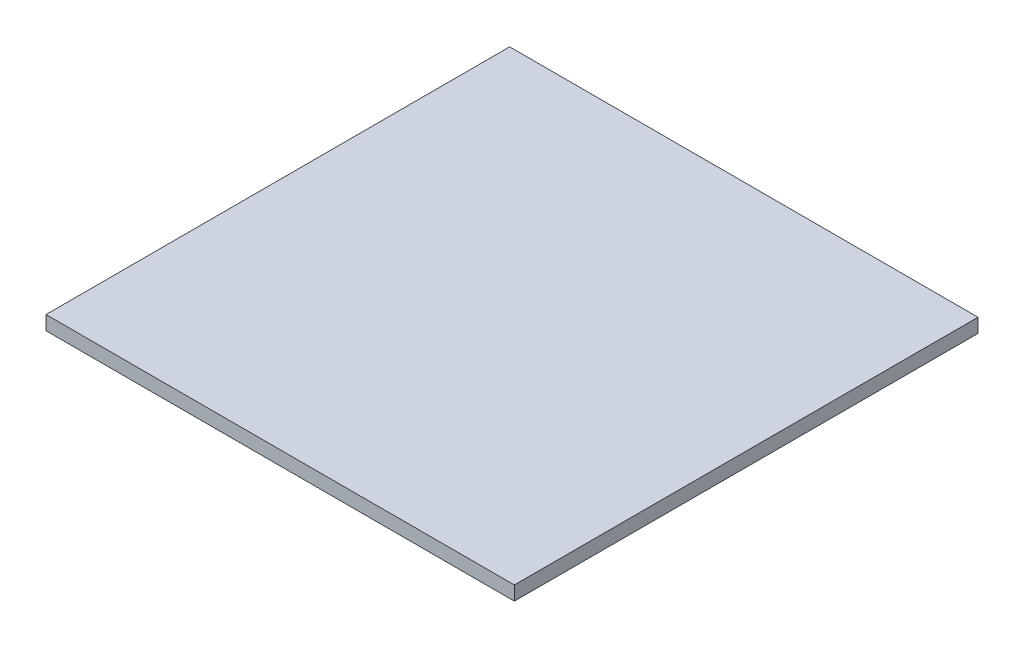
from build123d import *

# Parameters (mm, degrees)
SKETCH_1_W      = 50
SKETCH_1_H      = 49.5
EXTRUDE_1_DEPTH = 1.5


with BuildPart() as part:
    # Эскиз1 → Бобышка-Вытянуть1 (new body)
    with BuildSketch(Plane(origin=(0, 0, 0), x_dir=(1, 0, 0), z_dir=(0, 1, 0))):
        with Locations((0, 0.25)):
            Rectangle(SKETCH_1_W, SKETCH_1_H)
    extrude(amount=EXTRUDE_1_DEPTH)


solid = part.part
